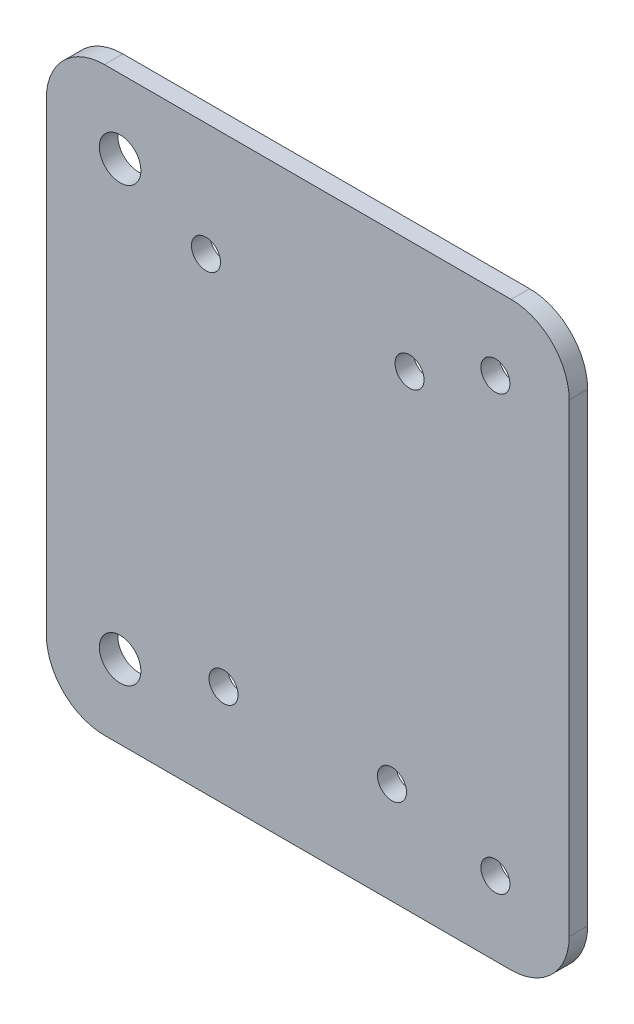
from build123d import *

# Parameters (mm, degrees)
SKETCH1_W           = 90
SKETCH1_H           = 100
SKETCH1_R           = 2.5
SKETCH1_R_2         = 3.57
BOSS_EXTRUDE1_DEPTH = 3.18
FILLET1_R           = 10
SKETCH2_R           = 2.5
CUT_EXTRUDE1_DEPTH  = 10


with BuildPart() as part:
    # Sketch1 → Boss-Extrude1 (new body)
    with BuildSketch(Plane.XY):
        with Locations((0, -5)):
            Rectangle(SKETCH1_W, SKETCH1_H)
        with Locations((32.3, -42.3)):
            Circle(SKETCH1_R, mode=Mode.SUBTRACT)
        with Locations((-32.3, -42.3)):
            Circle(SKETCH1_R_2, mode=Mode.SUBTRACT)
        with Locations((-32.3, 32.3)):
            Circle(SKETCH1_R_2, mode=Mode.SUBTRACT)
        with Locations((32.3, 32.3)):
            Circle(SKETCH1_R, mode=Mode.SUBTRACT)
    extrude(amount=-BOSS_EXTRUDE1_DEPTH)

    # Fillet1
    fillet1_edges = [part.edges().sort_by_distance(p)[0] for p in [
        (-45, 45, -1.59),
        (45, 45, -1.59),
        (45, -55, -1.59),
        (-45, -55, -1.59),
    ]]
    fillet(fillet1_edges, radius=FILLET1_R)

    # Sketch2 → Cut-Extrude1 (cut)
    with BuildSketch(Plane.XY):
        with Locations((-14.5, -37.5)):
            Circle(SKETCH2_R)
        with Locations((14.5, -37.5)):
            Circle(SKETCH2_R)
        with Locations((-17.523146435, 25.507758855)):
            Circle(SKETCH2_R)
        with Locations((17.523146435, 25.507758855)):
            Circle(SKETCH2_R)
    extrude(amount=-CUT_EXTRUDE1_DEPTH, mode=Mode.SUBTRACT)


solid = part.part
